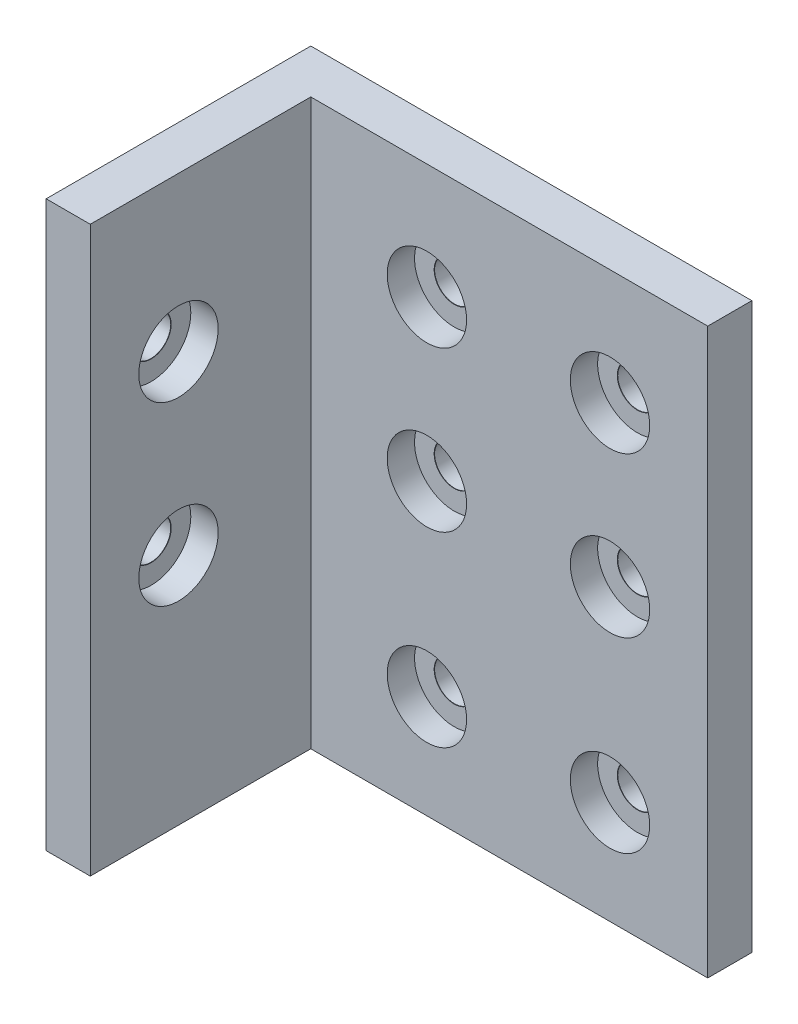
from build123d import *

# Parameters (mm, degrees)
ESQUISSE1_W                                  = 50
ESQUISSE1_H                                  = 64
BOSS_EXTRU_1_DEPTH                           = 30
ESQUISSE2_W                                  = 58.443807101
ESQUISSE2_H                                  = 34.604437798
ENL_V_MAT_EXTRU_1_DEPTH                      = 75.973328591
D_GAGEMENT_M41_D                             = 4.5
D_GAGEMENT_M42_D                             = 4.5
CHAMBRAGE_POUR_VIS_T_TE_RONDE_BOMB_2_COUNT   = 2
CHAMBRAGE_POUR_VIS_T_TE_RONDE_BOMB_2_PITCH   = 20.75901561
CHAMBRAGE_POUR_VIS_T_TE_RONDE_BOMB_3_COUNT   = 2
CHAMBRAGE_POUR_VIS_T_TE_RONDE_BOMB_3_PITCH   = 18.074069798
CHAMBRAGE_POUR_VIS_T_TE_RONDE_BOMB_4_COUNT   = 2
CHAMBRAGE_POUR_VIS_T_TE_RONDE_BOMB_4_PITCH   = 27.524693062
CHAMBRAGE_POUR_VIS_T_TE_RONDE_BOMB_5_COUNT   = 2
CHAMBRAGE_POUR_VIS_T_TE_RONDE_BOMB_5_PITCH   = 39.238665714
CHAMBRAGE_POUR_VIS_T_TE_RONDE_BOMB_6_COUNT   = 2
CHAMBRAGE_POUR_VIS_T_TE_RONDE_BOMB_6_PITCH   = 44.391548927
CHAMBRAGE_POUR_VIS_T_TE_RONDE_BOMB_7_A_COUNT = 2
CHAMBRAGE_POUR_VIS_T_TE_RONDE_BOMB_7_A_PITCH = 20


with BuildPart() as part:
    # Esquisse1 → Boss.-Extru.1 (new body)
    with BuildSketch(Plane.XY):
        Rectangle(ESQUISSE1_W, ESQUISSE1_H)
    extrude(amount=BOSS_EXTRU_1_DEPTH)

    # Esquisse2 → Enlèv. mat.-Extru.1 (cut, through all)
    with BuildSketch(Plane(origin=(0, 32, 0), x_dir=(1, 0, 0), z_dir=(0, 1, 0))):
        with Locations((9.221903551, -22.302218899)):
            Rectangle(ESQUISSE2_W, ESQUISSE2_H)
    extrude(amount=-ENL_V_MAT_EXTRU_1_DEPTH, mode=Mode.SUBTRACT)

    # Dégagement M41 (through all)
    with Locations(Plane(origin=(0, 0, 0), x_dir=(-1, 0, 0), z_dir=(0, 0, -1))):
        with Locations((6.838730229, 18.937151978), (-13.92028538, 18.937151978), (-13.92028538, 0.86308218), (6.838730229, 0.86308218), (6.838730229, -20.301513736), (-13.92028538, -20.301513736)):
            Hole(D_GAGEMENT_M41_D / 2)

    # Dégagement M42 (through all)
    with Locations(Plane.ZY.offset(25)):
        with Locations((20, 14.5), (20, -5.5)):
            Hole(D_GAGEMENT_M42_D / 2)

    # Esquisse7 → Chambrage pour vis _ t_te ronde bomb_e M (revolve, cut)
    with BuildSketch(Plane(origin=(13.92028538, 18.937151978, 5), x_dir=(0, -1, 0), z_dir=(1, 0, 0))):
        Polygon((0, 0), (0, 5), (2.25, 5), (2.25, 3.125), (2.275, 3.1), (4.5, 3.1), (4.5, 0), align=None)
    chambrage_pour_vis_t_te_ronde_bomb_e_m = revolve(axis=Axis((13.92028538, 18.937151978, 11.35), (0, 0, -1)), mode=Mode.SUBTRACT)

    # Chambrage pour vis _ t_te ronde bomb 2: Chambrage pour vis _ t_te ronde bomb_e M ×2
    with Locations(*[(-i * CHAMBRAGE_POUR_VIS_T_TE_RONDE_BOMB_2_PITCH, 0, 0) for i in range(1, CHAMBRAGE_POUR_VIS_T_TE_RONDE_BOMB_2_COUNT)]):
        add(chambrage_pour_vis_t_te_ronde_bomb_e_m, mode=Mode.SUBTRACT)

    # Chambrage pour vis _ t_te ronde bomb 3: Chambrage pour vis _ t_te ronde bomb_e M ×2
    with Locations(*[(0, -i * CHAMBRAGE_POUR_VIS_T_TE_RONDE_BOMB_3_PITCH, 0) for i in range(1, CHAMBRAGE_POUR_VIS_T_TE_RONDE_BOMB_3_COUNT)]):
        add(chambrage_pour_vis_t_te_ronde_bomb_e_m, mode=Mode.SUBTRACT)

    # Chambrage pour vis _ t_te ronde bomb 4: Chambrage pour vis _ t_te ronde bomb_e M ×2
    with Locations(*[Vector(-0.7541960799735443, -0.6566492769755702, 0) * (i * CHAMBRAGE_POUR_VIS_T_TE_RONDE_BOMB_4_PITCH) for i in range(1, CHAMBRAGE_POUR_VIS_T_TE_RONDE_BOMB_4_COUNT)]):
        add(chambrage_pour_vis_t_te_ronde_bomb_e_m, mode=Mode.SUBTRACT)

    # Chambrage pour vis _ t_te ronde bomb 5: Chambrage pour vis _ t_te ronde bomb_e M ×2
    with Locations(*[(0, -i * CHAMBRAGE_POUR_VIS_T_TE_RONDE_BOMB_5_PITCH, 0) for i in range(1, CHAMBRAGE_POUR_VIS_T_TE_RONDE_BOMB_5_COUNT)]):
        add(chambrage_pour_vis_t_te_ronde_bomb_e_m, mode=Mode.SUBTRACT)

    # Chambrage pour vis _ t_te ronde bomb 6: Chambrage pour vis _ t_te ronde bomb_e M ×2
    with Locations(*[Vector(-0.46763440590484284, -0.8839219775602509, 0) * (i * CHAMBRAGE_POUR_VIS_T_TE_RONDE_BOMB_6_PITCH) for i in range(1, CHAMBRAGE_POUR_VIS_T_TE_RONDE_BOMB_6_COUNT)]):
        add(chambrage_pour_vis_t_te_ronde_bomb_e_m, mode=Mode.SUBTRACT)

    # Esquisse9 → Chambrage pour vis _ t_te ronde bomb 7 (revolve, cut)
    with BuildSketch(Plane(origin=(-20, 14.5, 20), x_dir=(0, 0, -1), z_dir=(0, 1, 0))):
        Polygon((0, 0), (0, 5), (2.25, 5), (2.25, 3.125), (2.275, 3.1), (4.5, 3.1), (4.5, 0), align=None)
    chambrage_pour_vis_t_te_ronde_bomb_7 = revolve(axis=Axis((-13.65, 14.5, 20), (-1, 0, 0)), mode=Mode.SUBTRACT)

    # Chambrage pour vis _ t_te ronde bomb 7 a: Chambrage pour vis _ t_te ronde bomb 7 ×2
    with Locations(*[(0, -i * CHAMBRAGE_POUR_VIS_T_TE_RONDE_BOMB_7_A_PITCH, 0) for i in range(1, CHAMBRAGE_POUR_VIS_T_TE_RONDE_BOMB_7_A_COUNT)]):
        add(chambrage_pour_vis_t_te_ronde_bomb_7, mode=Mode.SUBTRACT)


solid = part.part
